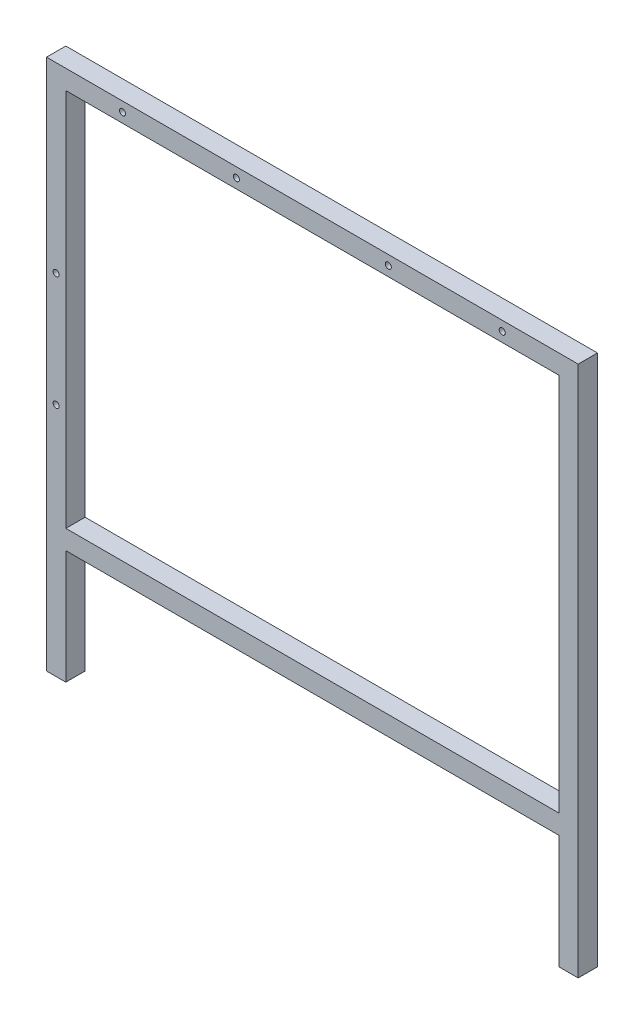
from build123d import *

# Parameters (mm, degrees)
SKETCH1_W           = 649.2
SKETCH1_H           = 25.4
BOSS_EXTRUDE3_DEPTH = 25.4
SKETCH15_R          = 4
CUT_EXTRUDE5_DEPTH  = 25.4
SKETCH11_R          = 4
CUT_EXTRUDE7_DEPTH  = 25.4


with BuildPart() as part:
    # Sketch1 → Boss-Extrude3 (new body)
    with BuildSketch(Plane.XY):
        Polygon((25.4, -700), (25.4, -25.4), (0, 0), (0, -700), align=None)
        Polygon((25.4, -25.4), (674.6, -25.4), (700, 0), (0, 0), align=None)
        Polygon((674.6, -25.4), (700, 0), (700, -700), (674.6, -700), align=None)
        with Locations((350, -537.3)):
            Rectangle(SKETCH1_W, SKETCH1_H)
    extrude(amount=-BOSS_EXTRUDE3_DEPTH)

    # Sketch15 → Cut-Extrude5 (cut)
    with BuildSketch(Plane.XY):
        with Locations((12.7, -240)):
            Circle(SKETCH15_R)
        with Locations((12.7, -390)):
            Circle(SKETCH15_R)
    extrude(amount=-CUT_EXTRUDE5_DEPTH, mode=Mode.SUBTRACT)

    # Sketch11 → Cut-Extrude7 (cut)
    with BuildSketch(Plane.XY):
        with Locations((100, -12.7)):
            Circle(SKETCH11_R)
        with Locations((250, -12.7)):
            Circle(SKETCH11_R)
        with Locations((600, -12.7)):
            Circle(SKETCH11_R)
        with Locations((450, -12.7)):
            Circle(SKETCH11_R)
    extrude(amount=-CUT_EXTRUDE7_DEPTH, mode=Mode.SUBTRACT)


solid = part.part
